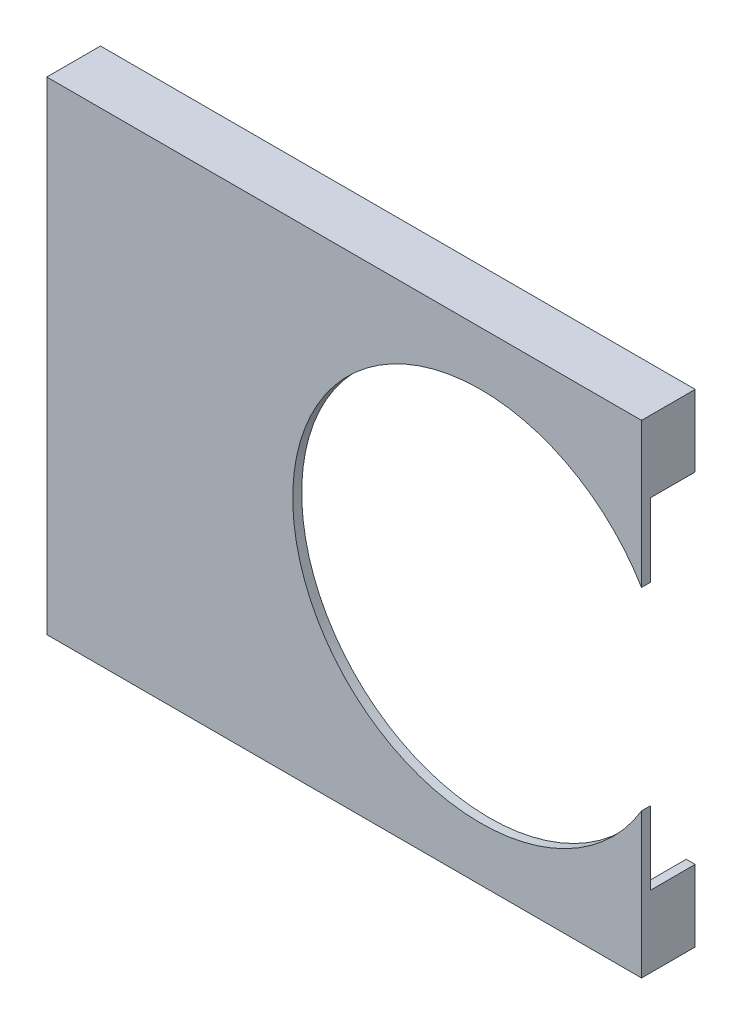
from build123d import *

# Parameters (mm, degrees)
BOSS_EXTRUDE1_DEPTH = 1
BOSS_EXTRUDE2_START = -1
BOSS_EXTRUDE2_DEPTH = 5


with BuildPart() as part:
    # Sketch1 → Boss-Extrude1 (new body)
    with BuildSketch(Plane.XY):
        with BuildLine():
            Line((33.25, 27), (-33.25, 27))
            Line((-33.25, 27), (-33.25, -27))
            Line((-33.25, -27), (33.25, -27))
            Line((33.25, -27), (33.25, -10.816653826))
            ThreePointArc((33.25, -10.816653826), (-5.75, 0), (33.25, 10.816653826))
            Line((33.25, 10.816653826), (33.25, 27))
        make_face()
    extrude(amount=BOSS_EXTRUDE1_DEPTH)

    # Sketch2 → Boss-Extrude2 (add)
    with BuildSketch(Plane.XY.offset(1).offset(BOSS_EXTRUDE2_START)):
        Polygon((33.25, -19), (32.25, -19), (32.25, -26), (-32.25, -26), (-32.25, -19), (-33.25, -19), (-33.25, -27), (33.25, -27), align=None)
        Polygon((33.25, 27), (-33.25, 27), (-33.25, 19), (-32.25, 19), (-32.25, 26), (32.25, 26), (32.25, 19), (33.25, 19), align=None)
    extrude(amount=-BOSS_EXTRUDE2_DEPTH)


solid = part.part
